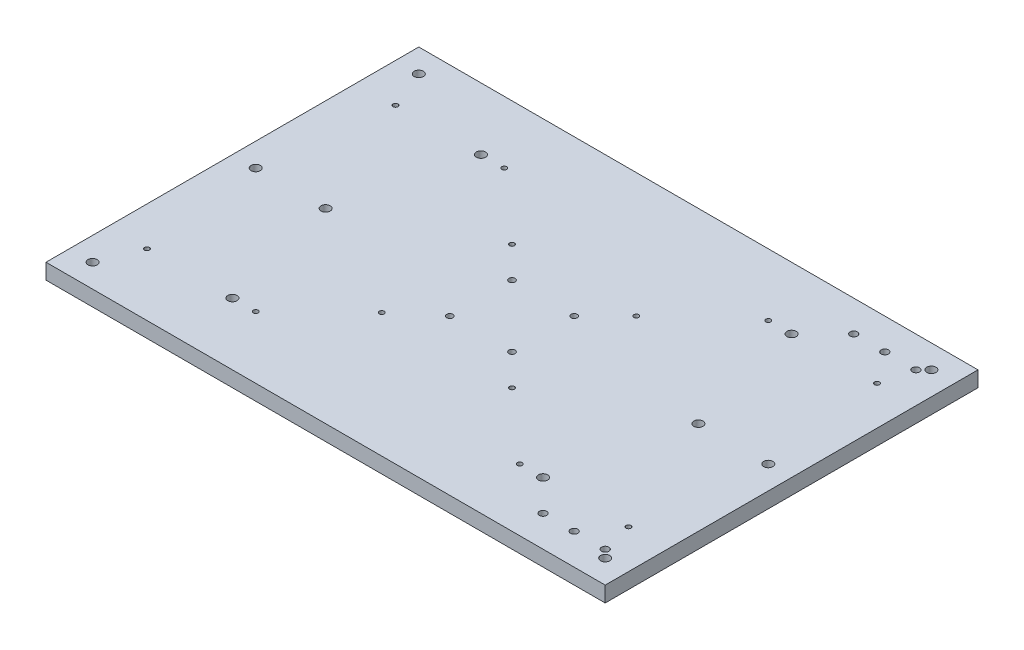
from build123d import *

# Parameters (mm, degrees)
SKETCH1_W                                        = 914.4
SKETCH1_H                                        = 609.6
BOSS_EXTRUDE1_DEPTH                              = 12.7
F_9_16_CLEARANCE_HOLE1_D                         = 15.07998
SKETCH5_R                                        = 5.08
CUT_EXTRUDE1_DEPTH                               = 2.54
CBORE_FOR_3_8_SOCKET_HEAD_CAP_SCREW1_D           = 10.0838
CBORE_FOR_3_8_SOCKET_HEAD_CAP_SCREW1_CBORE_D     = 15.875
CBORE_FOR_3_8_SOCKET_HEAD_CAP_SCREW1_CBORE_DEPTH = 9.525
F_3_8_16_TAPPED_HOLE1_D                          = 7.9375
F_3_8_16_TAPPED_HOLE2_D                          = 7.9375
F_7_16_CLEARANCE_HOLE1_D                         = 11.90498


with BuildPart() as part:
    # Sketch1 → Boss-Extrude1 (new, symmetric)
    with BuildSketch(Plane(origin=(0, 0, 0), x_dir=(1, 0, 0), z_dir=(0, 1, 0))):
        Rectangle(SKETCH1_W, SKETCH1_H)
    extrude(amount=BOSS_EXTRUDE1_DEPTH, both=True)

    # 9/16 Clearance Hole1 (through all)
    with Locations(Plane(origin=(0, 12.7, 0), x_dir=(1, 0, 0), z_dir=(0, 1, 0))):
        with Locations((419.1, 0), (-419.1, 266.7), (-419.1, -266.7), (-254, 203.2), (-254, -203.2), (304.8, 0)):
            f_9_16_clearance_hole1 = Hole(F_9_16_CLEARANCE_HOLE1_D / 2)

    # Sketch5 → Cut-Extrude1 (cut)
    with BuildSketch(Plane.XZ.offset(12.7)):
        with Locations(Location((161.29, 279.4, 0), (0, 0, 270))):
            Circle(SKETCH5_R)
        with Locations(Location((161.29, -279.4, 0), (0, 0, 270))):
            Circle(SKETCH5_R)
        with Locations(Location((-322.58, 0, 0), (0, 0, 270))):
            Circle(SKETCH5_R)
    extrude(amount=-CUT_EXTRUDE1_DEPTH, mode=Mode.SUBTRACT)

    # CBORE for 3/8 Socket Head Cap Screw1 (through all)
    with Locations(Plane(origin=(0, -12.7, 0), x_dir=(-1, 0, 0), z_dir=(0, -1, 0))):
        with Locations((50.8, -50.8), (-50.8, -50.8), (-50.8, 50.8), (50.8, 50.8)):
            CounterBoreHole(CBORE_FOR_3_8_SOCKET_HEAD_CAP_SCREW1_D / 2, CBORE_FOR_3_8_SOCKET_HEAD_CAP_SCREW1_CBORE_D / 2, CBORE_FOR_3_8_SOCKET_HEAD_CAP_SCREW1_CBORE_DEPTH)

    # 3/8-16 Tapped Hole1 (through all)
    with Locations(Plane(origin=(0, 12.7, 0), x_dir=(1, 0, 0), z_dir=(0, 1, 0))):
        with Locations((-101.6, 101.6), (101.6, 101.6), (101.6, -101.6), (-111.386656454, -101.6)):
            Hole(F_3_8_16_TAPPED_HOLE1_D / 2)

    # 3/8-16 Tapped Hole2 (through all)
    with Locations(Plane(origin=(0, 12.7, 0), x_dir=(1, 0, 0), z_dir=(0, 1, 0))):
        with Locations((215.9, 203.2), (393.7, 203.2), (393.7, -203.2), (215.9, -203.2)):
            f_3_8_16_tapped_hole2 = Hole(F_3_8_16_TAPPED_HOLE2_D / 2)

    # Mirror1: 3/8-16 Tapped Hole2 across plane
    add(f_3_8_16_tapped_hole2.mirror(Plane(origin=(0, 0, 0), x_dir=(0, 0, 1), z_dir=(1, 0, 0))), mode=Mode.SUBTRACT)

    # Mirror2: 9/16 Clearance Hole1 across plane
    add(f_9_16_clearance_hole1.mirror(Plane(origin=(0, 0, 0), x_dir=(0, 0, 1), z_dir=(1, 0, 0))), mode=Mode.SUBTRACT)

    # 7/16 Clearance Hole1 (through all)
    with Locations(Plane(origin=(0, 12.7, 0), x_dir=(1, 0, 0), z_dir=(0, 1, 0))):
        with Locations((406.4, -254), (355.6, -254), (304.8, -254)):
            f_7_16_clearance_hole1 = Hole(F_7_16_CLEARANCE_HOLE1_D / 2)

    # Mirror3: 7/16 Clearance Hole1 across plane
    add(f_7_16_clearance_hole1.mirror(Plane.XY), mode=Mode.SUBTRACT)


solid = part.part
